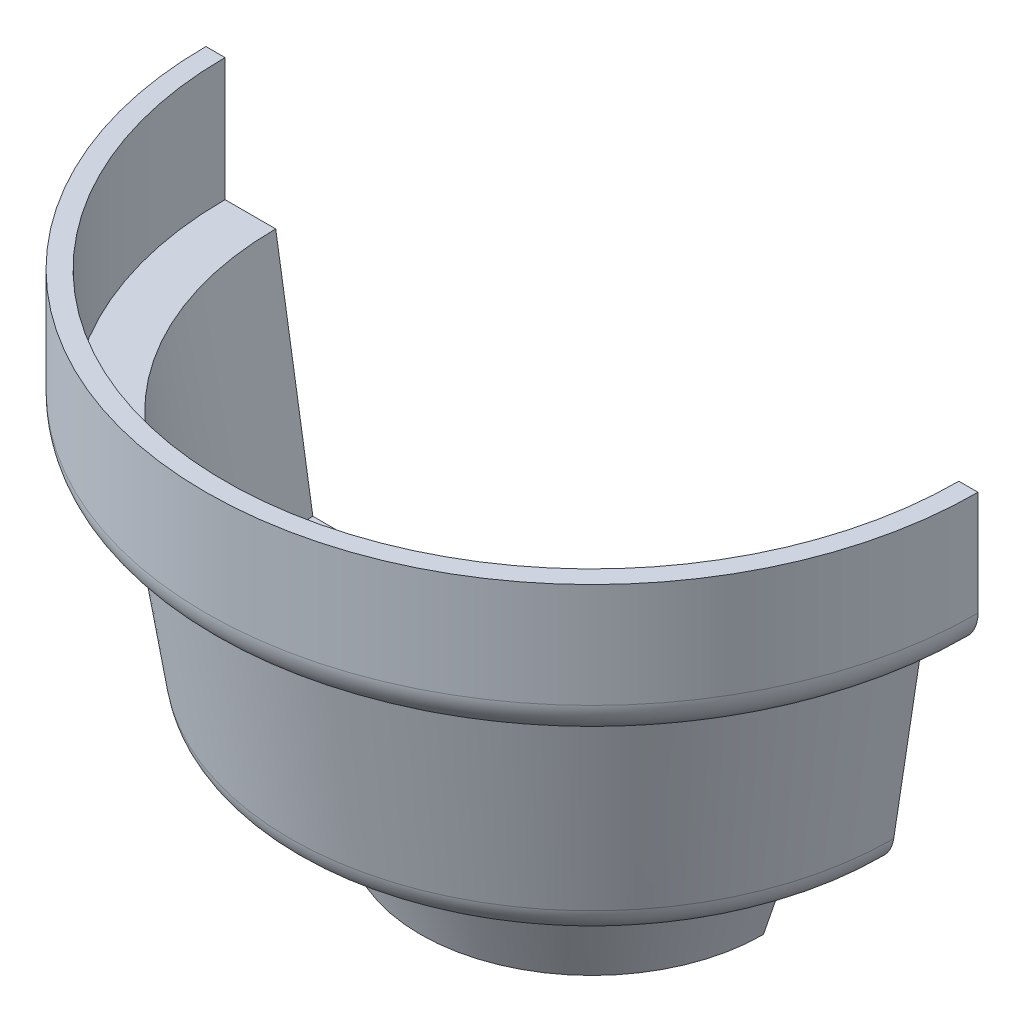
from build123d import *

# Parameters (mm, degrees)
REVOLVE2_ANGLE = 180
FILLET1_R      = 2
FILLET2_R      = 2


with BuildPart() as part:
    # Sketch1 → Revolve2 (revolve)
    with BuildSketch(Plane.XY):
        Polygon((298.984408478, 58.041083961), (302.019314835, 58.041083961), (304.061664281, 44.775692844), (308.932649078, 44.775692844), (311.24430288, 38.005849568), (313.986310635, 38.005849568), (313.986310635, 38.974632238), (312.008767265, 38.974632238), (309.907518568, 45.829224513), (308.932649078, 45.829224513), (305.095386851, 45.829224513), (302.974041332, 58.990397452), (300.078054647, 58.990397452), (300.078054647, 66.023507974), (298.984408478, 66.023507974), align=None)
    revolve(axis=Axis((321.047285869, 38.005849568, 0), (0, 1, 0)), revolution_arc=REVOLVE2_ANGLE)

    # Fillet1
    fillet1_edges = [part.edges().sort_by_distance(p)[0] for p in [
        (321.047285869, 58.041083961, 22.062877391),
    ]]
    fillet(fillet1_edges, radius=FILLET1_R)

    # Fillet2
    fillet2_edges = [part.edges().sort_by_distance(p)[0] for p in [
        (321.047285869, 44.775692844, 16.985621588),
    ]]
    fillet(fillet2_edges, radius=FILLET2_R)


solid = part.part
